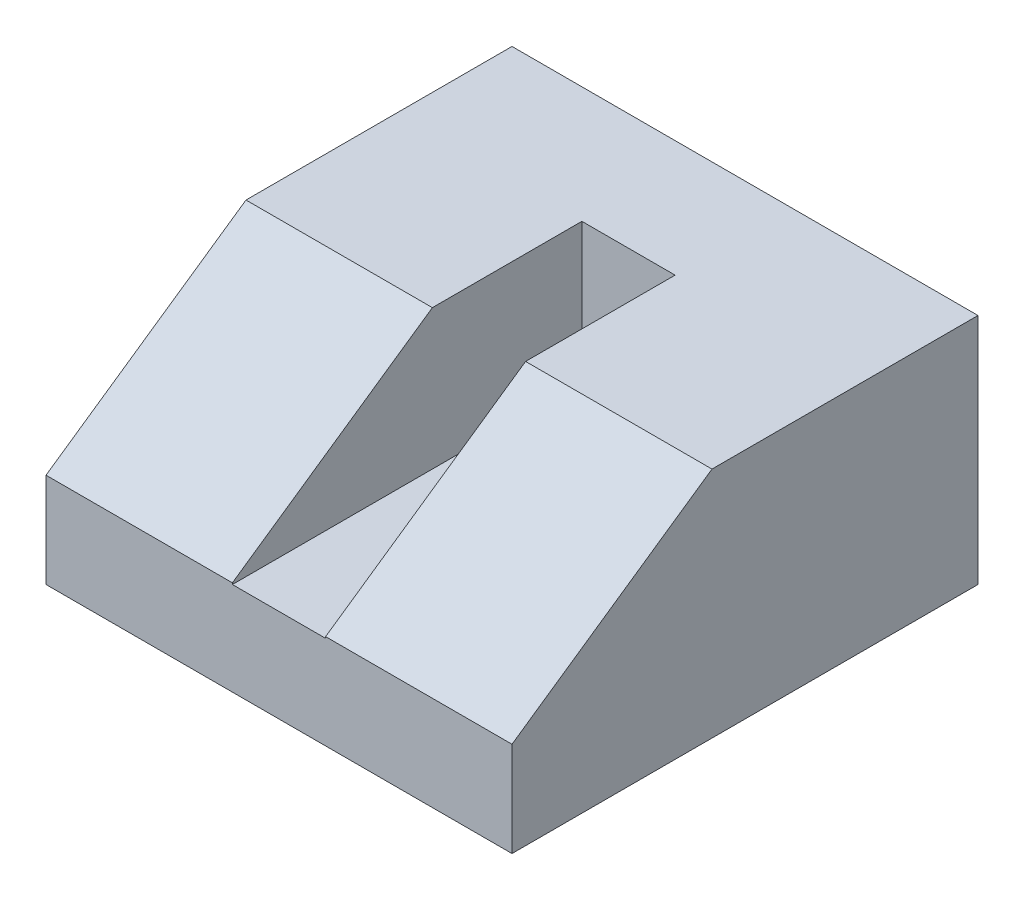
from build123d import *

# Parameters (mm, degrees)
SKETCH1_R           = 25
BOSS_EXTRUDE1_DEPTH = 10
SKETCH2_W           = 100
SKETCH2_H           = 100
BOSS_EXTRUDE2_DEPTH = 50
CUT_EXTRUDE1_DEPTH  = 127.885775404
SKETCH7_W           = 20
SKETCH7_H           = 75
CUT_EXTRUDE3_DEPTH  = 30


with BuildPart() as part:
    # Sketch1 → Boss-Extrude1 (new body)
    with BuildSketch(Plane(origin=(0, 0, 0), x_dir=(1, 0, 0), z_dir=(0, 1, 0))):
        Circle(SKETCH1_R)
    extrude(amount=BOSS_EXTRUDE1_DEPTH)

    # Sketch2 → Boss-Extrude2 (add)
    with BuildSketch(Plane(origin=(0, 10, 0), x_dir=(1, 0, 0), z_dir=(0, 1, 0))):
        Rectangle(SKETCH2_W, SKETCH2_H)
    extrude(amount=BOSS_EXTRUDE2_DEPTH)

    # Sketch4 → Cut-Extrude1 (cut, through all)
    with BuildSketch(Plane.ZY.offset(50)):
        Polygon((50, 30.318847412), (7.085498034, 60), (50, 60), align=None)
    extrude(amount=-CUT_EXTRUDE1_DEPTH, mode=Mode.SUBTRACT)

    # Sketch7 → Cut-Extrude3 (cut)
    with BuildSketch(Plane(origin=(0, 60, 0), x_dir=(1, 0, 0), z_dir=(0, 1, 0))):
        with Locations((0, -12.5)):
            Rectangle(SKETCH7_W, SKETCH7_H)
    extrude(amount=-CUT_EXTRUDE3_DEPTH, mode=Mode.SUBTRACT)


solid = part.part
